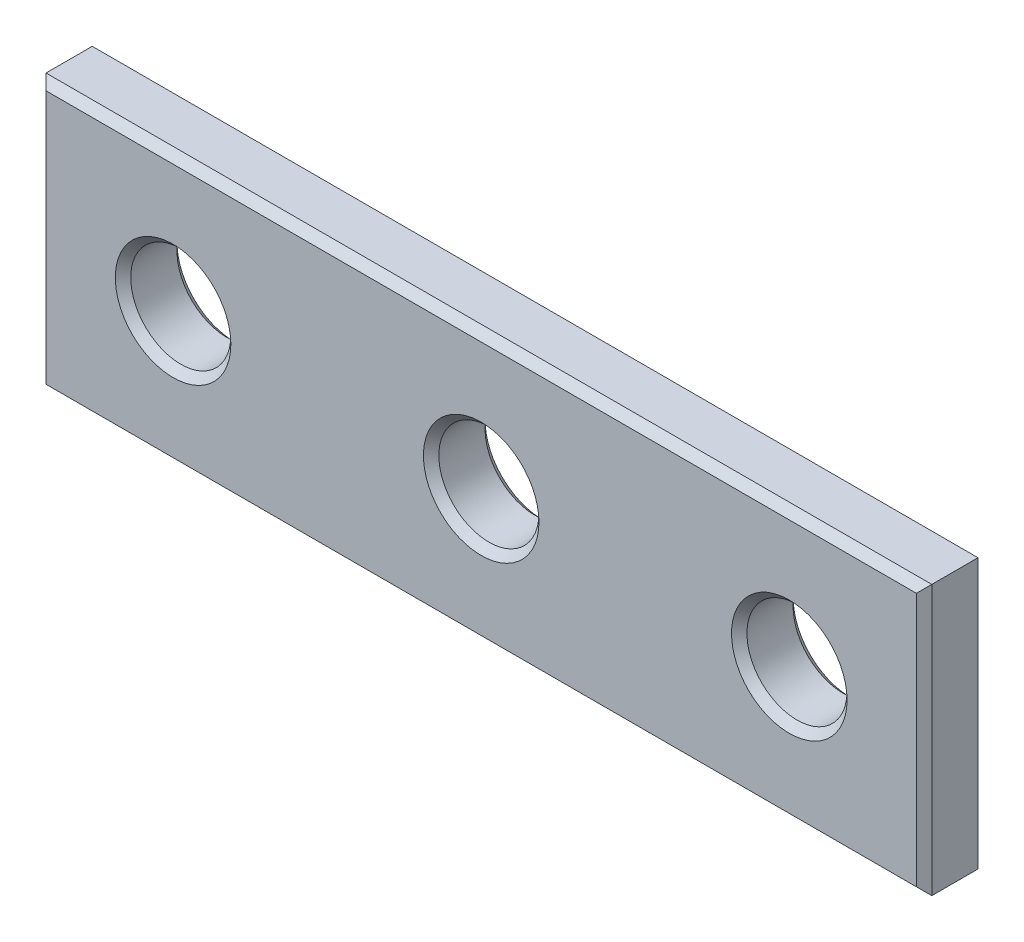
from build123d import *

# Parameters (mm, degrees)
SKETCH_1_W        = 230
SKETCH_1_H        = 70
SKETCH_1_R        = 13
EXTRUDE_365_DEPTH = 16
CHAMFER_1_SIZE    = 2


with BuildPart() as part:
    # 草图1 → Extrude 365 (new body)
    with BuildSketch(Plane.XY):
        Rectangle(SKETCH_1_W, SKETCH_1_H)
        Circle(SKETCH_1_R, mode=Mode.SUBTRACT)
        with Locations((80, 0)):
            Circle(SKETCH_1_R, mode=Mode.SUBTRACT)
        with Locations((-80, 0)):
            Circle(SKETCH_1_R, mode=Mode.SUBTRACT)
    extrude(amount=EXTRUDE_365_DEPTH)

    # 倒角1
    chamfer_1_edges = [part.edges().sort_by_distance(p)[0] for p in [
        (115, 0, 16),
        (-13, 0, 0),
        (-13, 0, 16),
        (0, 35, 16),
        (67, 0, 0),
        (67, 0, 16),
        (-93, 0, 0),
        (-93, 0, 16),
        (-115, 0, 16),
        (0, 35, 0),
        (115, 0, 0),
        (0, -35, 0),
        (-115, 0, 0),
        (0, -35, 16),
    ]]
    chamfer(chamfer_1_edges, length=CHAMFER_1_SIZE)


solid = part.part
